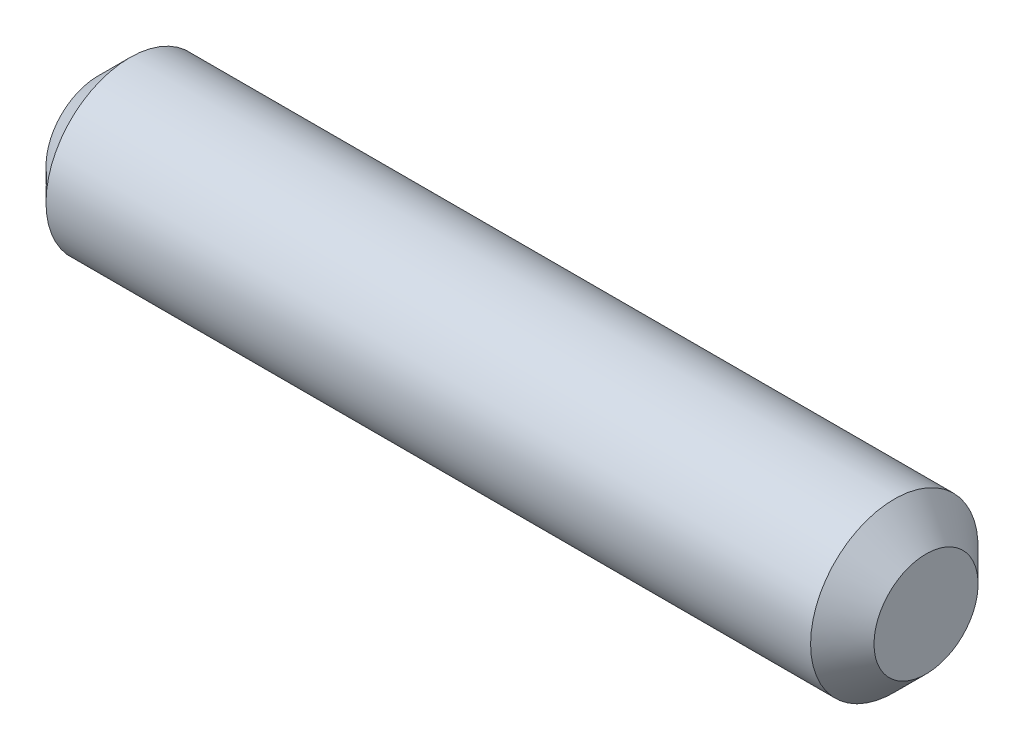
from build123d import *

# Parameters (mm, degrees)
SKETCH1_R           = 1.585
BOSS_EXTRUDE1_DEPTH = 7.835
CHAMFER1_SIZE       = 0.6


with BuildPart() as part:
    # Sketch1 → Boss-Extrude1 (new, symmetric)
    with BuildSketch(Plane(origin=(0, 0, 0), x_dir=(0, 0, -1), z_dir=(1, 0, 0))):
        Circle(SKETCH1_R)
    extrude(amount=BOSS_EXTRUDE1_DEPTH, both=True)

    # Chamfer1
    chamfer1_edges = [part.edges().sort_by_distance(p)[0] for p in [
        (-7.835, 0, 1.585),
        (7.835, 0, 1.585),
    ]]
    chamfer(chamfer1_edges, length=CHAMFER1_SIZE)


solid = part.part
